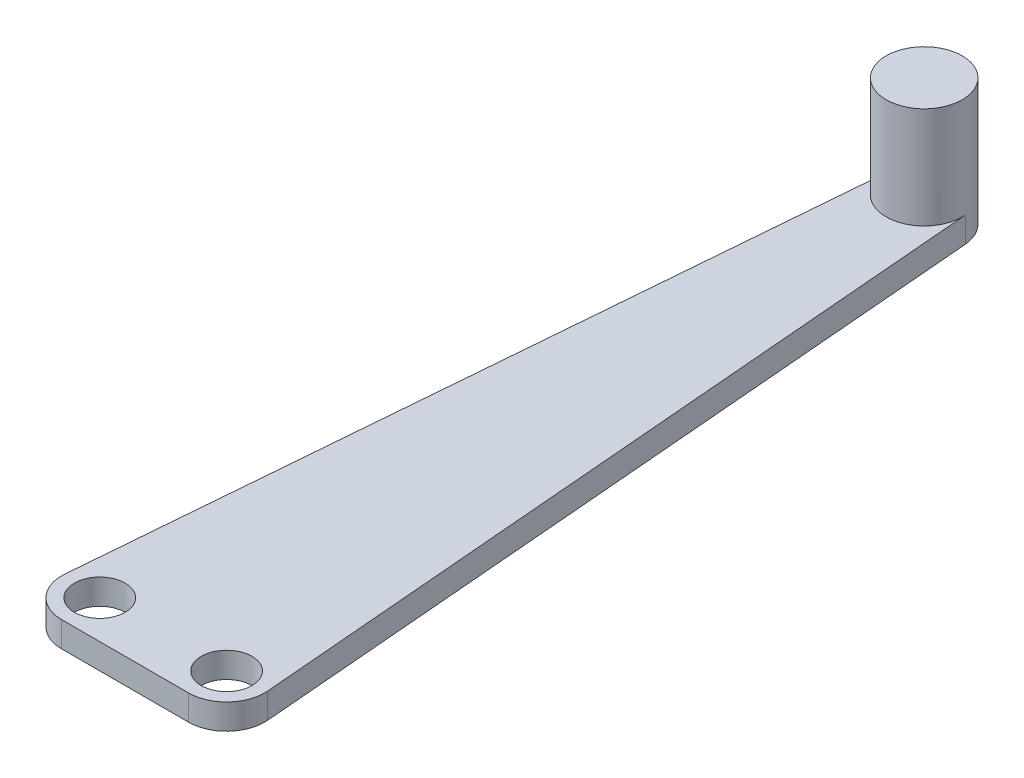
from build123d import *

# Parameters (mm, degrees)
SKETCH_1_R      = 15
SKETCH_1_R_2    = 10
EXTRUDE_1_DEPTH = 10
SKETCH_2_R      = 15
EXTRUDE_2_DEPTH = 40


with BuildPart() as part:
    # 草圖1 → 填料-伸長1 (new body)
    # profile 1 of 4: a face of its own
    with BuildSketch(Plane(origin=(0, 0, 0), x_dir=(1, 0, 0), z_dir=(0, 1, 0))):
        with BuildLine():
            ThreePointArc((-10, 0), (-14.393398282, -10.606601718), (-25, -15))
            Line((-25, -15), (25, -15))
            ThreePointArc((25, -15), (13.961765699, 10.156642335), (39.948186374, 1.245682198))
            Line((39.948186374, 1.245682198), (14.948186374, 301.245682198))
            ThreePointArc((14.948186374, 301.245682198), (14.987040996, 300.623379658), (15, 300))
            ThreePointArc((15, 300), (-0.623379658, 285.012959004), (-14.948186374, 301.245682198))
            Line((-14.948186374, 301.245682198), (-39.948186374, 1.245682198))
            ThreePointArc((-39.948186374, 1.245682198), (-24.376620342, 14.987040996), (-10, 0))
        make_face()
    # profile 2 of 4: a face of its own
    with BuildSketch(Plane(origin=(0, 0, 0), x_dir=(1, 0, 0), z_dir=(0, 1, 0))):
        with Locations((-25, 0)):
            Circle(SKETCH_1_R)
        with Locations(Location((-25, 0, 0), (0, 0, 270))):
            Circle(SKETCH_1_R_2, mode=Mode.SUBTRACT)
    # profile 3 of 4: a face of its own
    with BuildSketch(Plane(origin=(0, 0, 0), x_dir=(1, 0, 0), z_dir=(0, 1, 0))):
        with Locations((25, 0)):
            Circle(SKETCH_1_R)
        with Locations(Location((25, 0, 0), (0, 0, 270))):
            Circle(SKETCH_1_R_2, mode=Mode.SUBTRACT)
    # profile 4 of 4: a face of its own
    with BuildSketch(Plane(origin=(0, 0, 0), x_dir=(1, 0, 0), z_dir=(0, 1, 0))):
        with Locations((0, 300)):
            Circle(SKETCH_1_R)
        with Locations(Location((0, 300, 0), (0, 0, 270))):
            Circle(SKETCH_1_R_2, mode=Mode.SUBTRACT)
    extrude(amount=EXTRUDE_1_DEPTH)

    # 草圖2 → 填料-伸長2 (add)
    with BuildSketch(Plane(origin=(0, 10, 0), x_dir=(1, 0, 0), z_dir=(0, 1, 0))):
        with Locations(Location((0, 300, 0), (0, 0, 4.763641691))):
            Circle(SKETCH_2_R)
    extrude(amount=EXTRUDE_2_DEPTH)


solid = part.part
